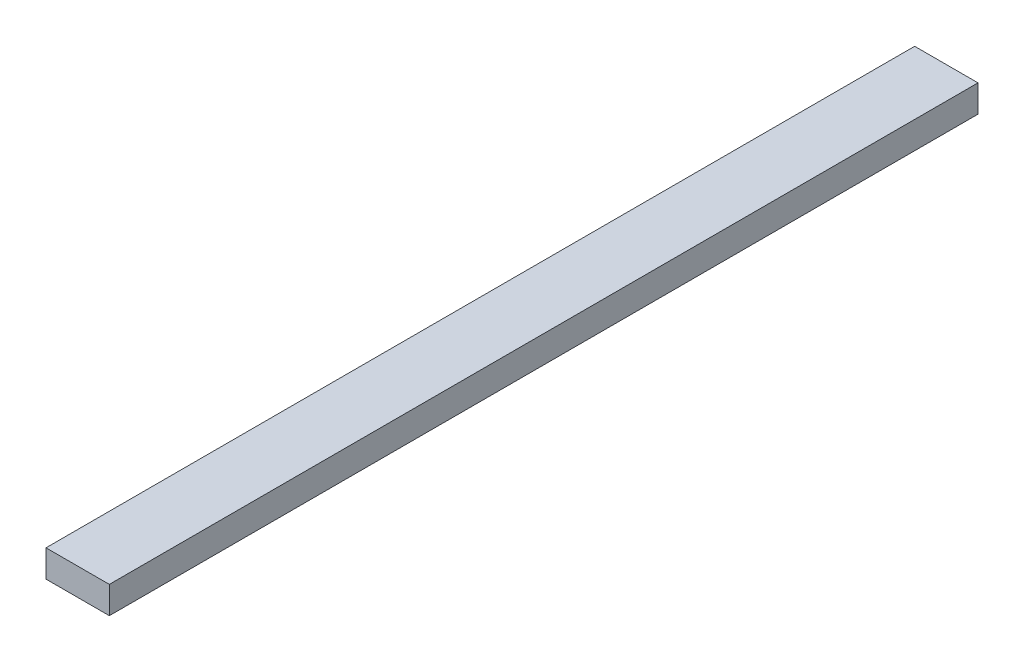
from build123d import *

# Parameters (mm, degrees)
SKETCH1_W           = 88.9
SKETCH1_H           = 38.1
BOSS_EXTRUDE1_DEPTH = 1219.2


with BuildPart() as part:
    # Sketch1 → Boss-Extrude1 (new body)
    with BuildSketch(Plane.XY):
        with Locations((44.45, 19.05)):
            Rectangle(SKETCH1_W, SKETCH1_H)
    extrude(amount=BOSS_EXTRUDE1_DEPTH)


solid = part.part
